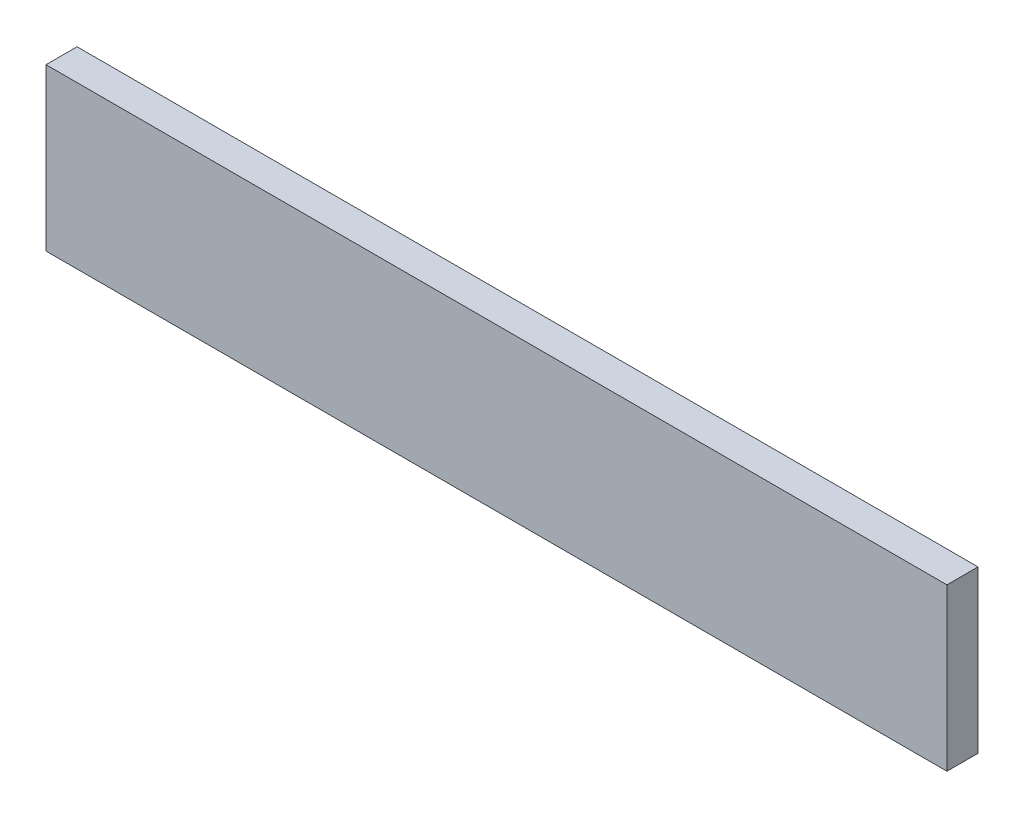
from build123d import *

# Parameters (mm, degrees)
SKETCH1_W           = 552.45
SKETCH1_H           = 99.00158
BOSS_EXTRUDE1_DEPTH = 19.05


with BuildPart() as part:
    # Sketch1 → Boss-Extrude1 (new body)
    with BuildSketch(Plane.XY):
        Rectangle(SKETCH1_W, SKETCH1_H)
    extrude(amount=BOSS_EXTRUDE1_DEPTH)


solid = part.part
